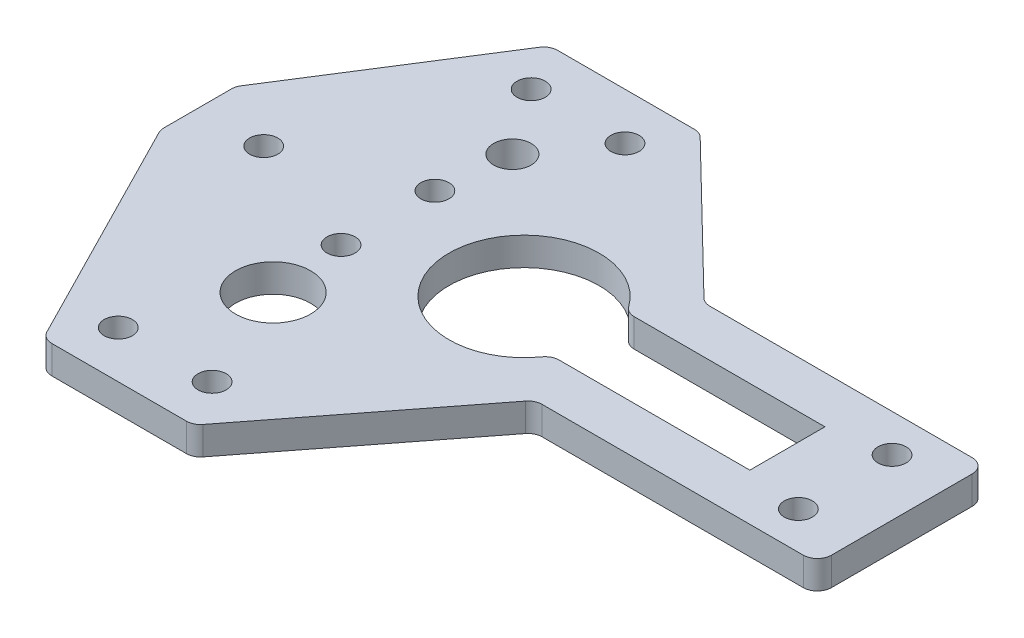
from build123d import *

# Parameters (mm, degrees)
ESQUISSE1_R             = 1.5
ESQUISSE1_R_2           = 2
ESQUISSE1_R_3           = 4
BOSS_EXTRU_1_DEPTH      = 3
ESQUISSE4_R             = 2.563154281
ESQUISSE4_W             = 9.437600028
ESQUISSE4_H             = 17.69995175
BOSS_EXTRU_3_DEPTH      = 3
ESQUISSE5_R             = 1.5
ENL_V_MAT_EXTRU_1_DEPTH = 10
ESQUISSE6_R             = 1.5
BOSS_EXTRU_5_DEPTH      = 3
ESQUISSE7_R             = 1.5
ENL_V_MAT_EXTRU_2_DEPTH = 3
ESQUISSE8_R             = 1.5
ENL_V_MAT_EXTRU_3_DEPTH = 3
BOSS_EXTRU_7_DEPTH      = 3


with BuildPart() as part:
    # Esquisse1 → Boss.-Extru.1 (new body)
    with BuildSketch(Plane(origin=(0, 3, 0), x_dir=(1, 0, 0), z_dir=(0, 1, 0))):
        with BuildLine():
            Line((-24.441801488, 23.803313038), (-36.766762868, 4.367797016))
            ThreePointArc((-36.766762868, 4.367797016), (-36.940511073, 3.982727746), (-37, 3.564483978))
            Line((-37, 3.564483978), (-37, -3.639706512))
            ThreePointArc((-37, -3.639706512), (-36.958516169, -3.990035764), (-36.83635922, -4.320987683))
            Line((-36.83635922, -4.320987683), (-24.41738607, -28.681281171))
            ThreePointArc((-24.41738607, -28.681281171), (-23.864633333, -29.279046863), (-23.081026849, -29.5))
            Line((-23.081026849, -29.5), (-8.734084726, -29.5))
            ThreePointArc((-8.734084726, -29.5), (-8.074724869, -29.347310127), (-7.549601775, -28.920326105))
            Line((-7.549601775, -28.920326105), (7.477805006, -9.579673895))
            ThreePointArc((7.477805006, -9.579673895), (8.002928099, -9.152689873), (8.662287956, -9))
            Line((8.662287956, -9), (36.5, -9))
            ThreePointArc((36.5, -9), (37.560660172, -8.560660172), (38, -7.5))
            Line((38, -7.5), (38, 7.5))
            ThreePointArc((38, 7.5), (37.560660172, 8.560660172), (36.5, 9))
            Line((36.5, 9), (8.537585972, 9))
            ThreePointArc((8.537585972, 9), (7.973014245, 9.110302635), (7.491474184, 9.424988313))
            Line((7.491474184, 9.424988313), (-7.563270954, 24.075011687))
            ThreePointArc((-7.563270954, 24.075011687), (-8.044811015, 24.389697365), (-8.609382741, 24.5))
            Line((-8.609382741, 24.5), (-23.17503862, 24.5))
            ThreePointArc((-23.17503862, 24.5), (-23.897890764, 24.314338152), (-24.441801488, 23.803313038))
        make_face()
        with Locations(Location((33, -5, 0), (0, 0, 90))):
            Circle(ESQUISSE1_R, mode=Mode.SUBTRACT)
        with Locations(Location((-16, 12.5, 0), (0, 0, 90))):
            Circle(ESQUISSE1_R_2, mode=Mode.SUBTRACT)
        with Locations(Location((-21, -24.5, 0), (0, 0, 90))):
            Circle(ESQUISSE1_R, mode=Mode.SUBTRACT)
        with Locations(Location((-21, 19.5, 0), (0, 0, 90))):
            Circle(ESQUISSE1_R, mode=Mode.SUBTRACT)
        with Locations(Location((-16, -5, 0), (0, 0, 90))):
            Circle(ESQUISSE1_R, mode=Mode.SUBTRACT)
        with Locations(Location((-16, 5, 0), (0, 0, 90))):
            Circle(ESQUISSE1_R, mode=Mode.SUBTRACT)
        with Locations(Location((-11, 19.5, 0), (0, 0, 90))):
            Circle(ESQUISSE1_R, mode=Mode.SUBTRACT)
        with Locations(Location((-11, -24.5, 0), (0, 0, 90))):
            Circle(ESQUISSE1_R, mode=Mode.SUBTRACT)
        with Locations(Location((-32, 0, 0), (0, 0, 90))):
            Circle(ESQUISSE1_R, mode=Mode.SUBTRACT)
        with Locations(Location((-16, -13, 0), (0, 0, 90))):
            Circle(ESQUISSE1_R_3, mode=Mode.SUBTRACT)
        with Locations(Location((33, 5, 0), (0, 0, 90))):
            Circle(ESQUISSE1_R, mode=Mode.SUBTRACT)
        with BuildLine():
            Line((-26.75, -5), (-26.75, 5))
            ThreePointArc((-26.75, 5), (-26.017766953, 6.767766953), (-24.25, 7.5))
            Line((-24.25, 7.5), (-21.75, 7.5))
            ThreePointArc((-21.75, 7.5), (-19.982233047, 6.767766953), (-19.25, 5))
            Line((-19.25, 5), (-19.25, -5))
            ThreePointArc((-19.25, -5), (-19.982233047, -6.767766953), (-21.75, -7.5))
            Line((-21.75, -7.5), (-24.25, -7.5))
            ThreePointArc((-24.25, -7.5), (-26.017766953, -6.767766953), (-26.75, -5))
        make_face(mode=Mode.SUBTRACT)
        with BuildLine():
            Line((27.25, 2.5), (27.25, -2.5))
            ThreePointArc((27.25, -2.5), (26.810660172, -3.560660172), (25.75, -4))
            Line((25.75, -4), (7.745966692, -4))
            ThreePointArc((7.745966692, -4), (7.057719491, -4.167215025), (6.52291932, -4.631578947))
            ThreePointArc((6.52291932, -4.631578947), (-8, 0), (6.52291932, 4.631578947))
            ThreePointArc((6.52291932, 4.631578947), (7.057719491, 4.167215025), (7.745966692, 4))
            Line((7.745966692, 4), (25.75, 4))
            ThreePointArc((25.75, 4), (26.810660172, 3.560660172), (27.25, 2.5))
        make_face(mode=Mode.SUBTRACT)
    extrude(amount=-BOSS_EXTRU_1_DEPTH)

    # Esquisse4 → Boss.-Extru.3 (add)
    with BuildSketch(Plane(origin=(0, 3, 0), x_dir=(1, 0, 0), z_dir=(0, 1, 0))):
        with Locations((-32, 0)):
            Circle(ESQUISSE4_R)
        with BuildLine():
            Line((-8.428765835, 5.31043864), (-10.28347554, 5.31043864))
            Line((-10.28347554, 5.31043864), (-10.28347554, -6.18848711))
            Line((-10.28347554, -6.18848711), (-7.806886661, -6.18848711))
            ThreePointArc((-7.806886661, -6.18848711), (0, -9.96217105), (7.806886661, -6.18848711))
            Line((7.806886661, -6.18848711), (29.357557964, -6.18848711))
            Line((29.357557964, -6.18848711), (29.357557964, 5.31043864))
            Line((29.357557964, 5.31043864), (8.428765835, 5.31043864))
            ThreePointArc((8.428765835, 5.31043864), (0, 9.96217105), (-8.428765835, 5.31043864))
        make_face()
        with Locations((-22.804360287, -0.041920648)):
            Rectangle(ESQUISSE4_W, ESQUISSE4_H)
    extrude(amount=-BOSS_EXTRU_3_DEPTH)

    # Esquisse5 → Enlèv. mat.-Extru.1 (cut)
    with BuildSketch(Plane(origin=(0, 3, 0), x_dir=(1, 0, 0), z_dir=(0, 1, 0))):
        with Locations(Location((-30, 0, 0), (0, 0, 270))):
            Circle(ESQUISSE5_R)
        with BuildLine():
            Line((5.485812833, 4), (25.805812833, 4))
            Line((25.805812833, 4), (25.805812833, -4))
            Line((25.805812833, -4), (5.485812833, -4))
            ThreePointArc((5.485812833, -4), (4.797565631, -4.167215025), (4.26276546, -4.631578947))
            ThreePointArc((4.26276546, -4.631578947), (-10.26015386, 0), (4.26276546, 4.631578947))
            ThreePointArc((4.26276546, 4.631578947), (4.797565631, 4.167215025), (5.485812833, 4))
        make_face()
    extrude(amount=-ENL_V_MAT_EXTRU_1_DEPTH, mode=Mode.SUBTRACT)

    # Esquisse6 → Boss.-Extru.5 (add)
    with BuildSketch(Plane(origin=(0, 3, 0), x_dir=(1, 0, 0), z_dir=(0, 1, 0))):
        with Locations((33, 5)):
            Circle(ESQUISSE6_R)
        with Locations((33, -5)):
            Circle(ESQUISSE6_R)
    extrude(amount=-BOSS_EXTRU_5_DEPTH)

    # Esquisse7 → Enlèv. mat.-Extru.2 (cut)
    with BuildSketch(Plane(origin=(0, 3, 0), x_dir=(1, 0, 0), z_dir=(0, 1, 0))):
        with Locations(Location((31.975486082, 4.984695173, 0), (0, 0, 270))):
            Circle(ESQUISSE7_R)
        with Locations(Location((31.975486082, -5, 0), (0, 0, 270))):
            Circle(ESQUISSE7_R)
    extrude(amount=-ENL_V_MAT_EXTRU_2_DEPTH, mode=Mode.SUBTRACT)

    # Esquisse8 → Enlèv. mat.-Extru.3 (cut)
    with BuildSketch(Plane(origin=(0, 3, 0), x_dir=(1, 0, 0), z_dir=(0, 1, 0))):
        with Locations((-16.759449345, 5)):
            Circle(ESQUISSE8_R)
        with Locations((-16, 5)):
            Circle(ESQUISSE8_R)
        with Locations((-16.759449345, -5)):
            Circle(ESQUISSE8_R)
        with Locations((-16, -5)):
            Circle(ESQUISSE8_R)
    extrude(amount=-ENL_V_MAT_EXTRU_3_DEPTH, mode=Mode.SUBTRACT)

    # Esquisse10 → Boss.-Extru.7 (add)
    with BuildSketch(Plane(origin=(0, 3, 0), x_dir=(1, 0, 0), z_dir=(0, 1, 0))):
        with BuildLine():
            ThreePointArc((-16.379724673, 3.548859355), (-15.259449345, 5), (-16.379724673, 6.451140645))
            ThreePointArc((-16.379724673, 6.451140645), (-14.5, 5), (-16.379724673, 3.548859355))
        make_face()
        with BuildLine():
            ThreePointArc((-16.379724673, -6.451140645), (-15.259449345, -5), (-16.379724673, -3.548859355))
            ThreePointArc((-16.379724673, -3.548859355), (-14.5, -5), (-16.379724673, -6.451140645))
        make_face()
    extrude(amount=-BOSS_EXTRU_7_DEPTH)


solid = part.part
